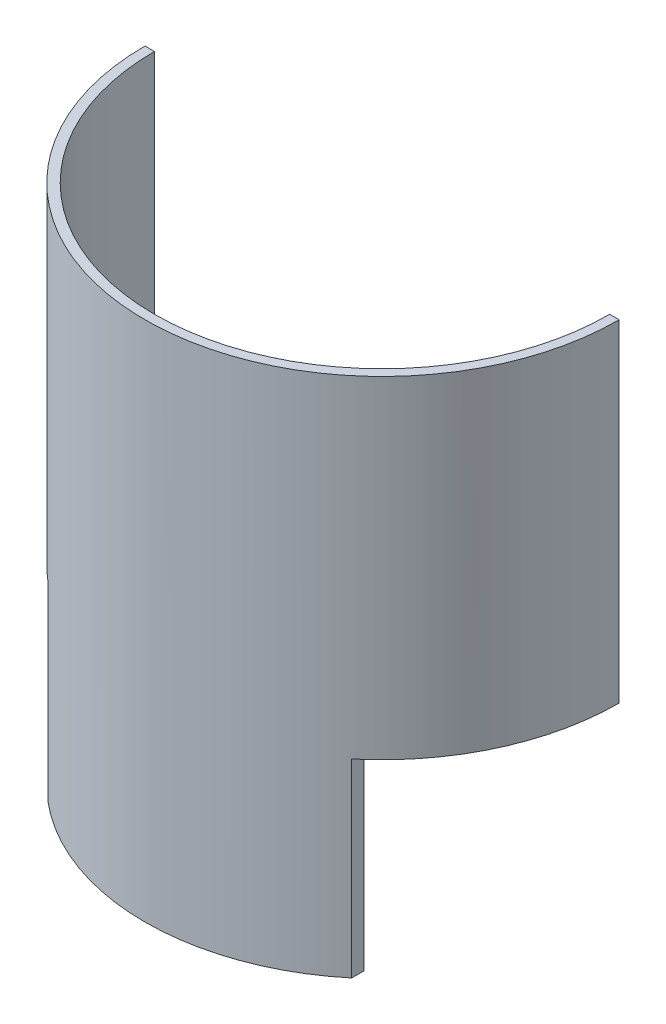
from build123d import *

# Parameters (mm, degrees)
BOSS_EXTRUDE1_DEPTH = 10
BOSS_EXTRUDE2_START = 10
BOSS_EXTRUDE2_DEPTH = 17.5
CUT_EXTRUDE1_DEPTH  = 10
BOSS_EXTRUDE3_DEPTH = 10


with BuildPart() as part:
    # Sketch1 → Boss-Extrude1 (new body)
    with BuildSketch(Plane(origin=(0, 0, 0), x_dir=(1, 0, 0), z_dir=(0, 1, 0))):
        with BuildLine():
            Line((-8, -8.94427191), (-8, -9.604686356))
            ThreePointArc((-8, -9.604686356), (0, -12.5), (8, -9.604686356))
            Line((8, -9.604686356), (8, -8.94427191))
            ThreePointArc((8, -8.94427191), (0, -12), (-8, -8.94427191))
        make_face()
    extrude(amount=BOSS_EXTRUDE1_DEPTH)

    # Sketch1<3> → Boss-Extrude2 (add)
    with BuildSketch(Plane(origin=(0, 0, 0), x_dir=(1, 0, 0), z_dir=(0, 1, 0)).offset(BOSS_EXTRUDE2_START)):
        with BuildLine():
            Line((-12, 0), (-12.5, 0))
            ThreePointArc((-12.5, 0), (-11.319231423, -5.303300859), (-8, -9.604686356))
            Line((-8, -9.604686356), (-8, -8.94427191))
            ThreePointArc((-8, -8.94427191), (-10.95445115, -4.898979486), (-12, 0))
        make_face()
        with BuildLine():
            Line((-8, -8.94427191), (-8, -9.604686356))
            ThreePointArc((-8, -9.604686356), (0, -12.5), (8, -9.604686356))
            Line((8, -9.604686356), (8, -8.94427191))
            ThreePointArc((8, -8.94427191), (0, -12), (-8, -8.94427191))
        make_face()
        with BuildLine():
            Line((8, -8.94427191), (8, -9.604686356))
            ThreePointArc((8, -9.604686356), (11.319231423, -5.303300859), (12.5, 0))
            Line((12.5, 0), (12, 0))
            ThreePointArc((12, 0), (10.95445115, -4.898979486), (8, -8.94427191))
        make_face()
    extrude(amount=BOSS_EXTRUDE2_DEPTH)

    # Sketch2 → Cut-Extrude1 (cut)
    with BuildSketch(Plane.XZ):
        with BuildLine():
            Line((8, 8.94427191), (8, 9.604686356))
            ThreePointArc((8, 9.604686356), (0, 12.5), (-8, 9.604686356))
            Line((-8, 9.604686356), (-8, 8.94427191))
            ThreePointArc((-8, 8.94427191), (0, 12), (8, 8.94427191))
        make_face()
    extrude(amount=-CUT_EXTRUDE1_DEPTH, mode=Mode.SUBTRACT)

    # Sketch2<2> → Boss-Extrude3 (add)
    with BuildSketch(Plane.XZ):
        with BuildLine():
            Line((8, 8.94427191), (8, 9.604686356))
            ThreePointArc((8, 9.604686356), (0, 12.5), (-8, 9.604686356))
            Line((-8, 9.604686356), (-8, 8.94427191))
            ThreePointArc((-8, 8.94427191), (0, 12), (8, 8.94427191))
        make_face()
    extrude(amount=-BOSS_EXTRUDE3_DEPTH)


solid = part.part
